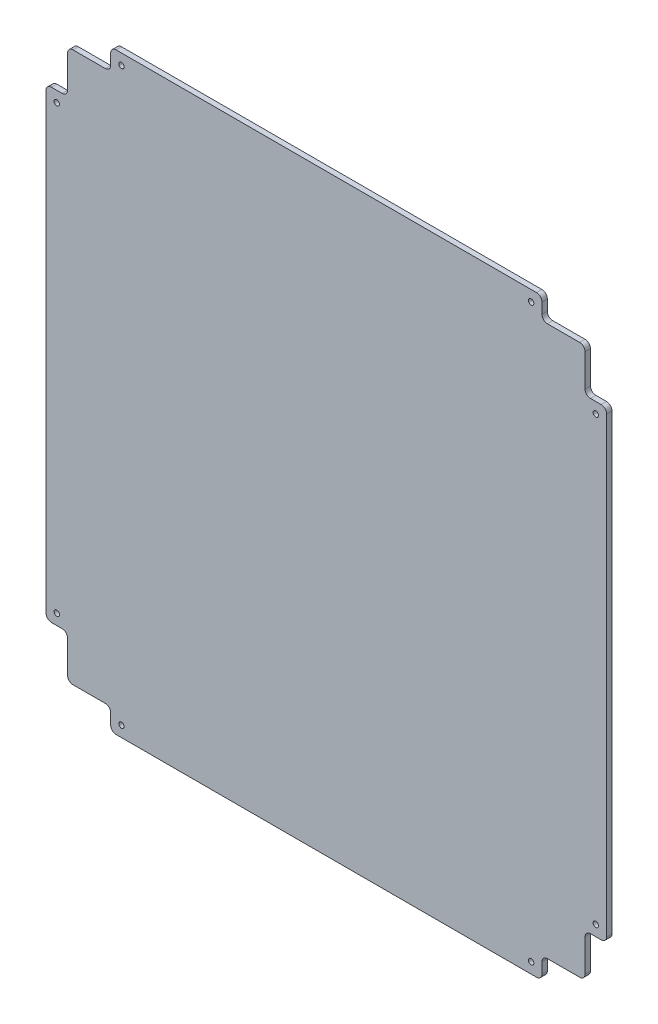
from build123d import *

# Parameters (mm, degrees)
SKETCH_1_W          = 520
SKETCH_1_H          = 550
EXTRUDE_1_DEPTH     = 5
SKETCH_2_R          = 2.5
CUT_EXTRUDE_2_DEPTH = 379.483817356
FILLET_2_R          = 5


with BuildPart() as part:
    # 草图1 → 凸台-拉伸1 (new body)
    with BuildSketch(Plane.XY):
        Rectangle(SKETCH_1_W, SKETCH_1_H)
    extrude(amount=EXTRUDE_1_DEPTH)

    # 草图2 → 切除-拉伸2 (cut, through all)
    with BuildSketch(Plane.XY.offset(5)):
        with Locations((-190, 265)):
            Circle(SKETCH_2_R)
        with Locations((190, 265)):
            Circle(SKETCH_2_R)
        with Locations((250, 205)):
            Circle(SKETCH_2_R)
        with Locations((-250, 205)):
            Circle(SKETCH_2_R)
        with Locations((-250, -205)):
            Circle(SKETCH_2_R)
        with Locations((-190, -265)):
            Circle(SKETCH_2_R)
        with Locations((190, -265)):
            Circle(SKETCH_2_R)
        with Locations((250, -205)):
            Circle(SKETCH_2_R)
        Polygon((240, 255), (200, 255), (200, 275), (260, 275), (260, 215), (240, 215), align=None)
        Polygon((-240, 255), (-240, 215), (-260, 215), (-260, 275), (-200, 275), (-200, 255), align=None)
        Polygon((-240, -255), (-200, -255), (-200, -275), (-260, -275), (-260, -215), (-240, -215), align=None)
        Polygon((240, -255), (240, -215), (260, -215), (260, -275), (200, -275), (200, -255), align=None)
    extrude(amount=-CUT_EXTRUDE_2_DEPTH, mode=Mode.SUBTRACT)

    # 圆角2
    fillet_2_edges = [part.edges().sort_by_distance(p)[0] for p in [
        (260, 215, 2.5),
        (240, 215, 2.5),
        (240, 255, 2.5),
        (200, 255, 2.5),
        (200, 275, 2.5),
        (-200, 275, 2.5),
        (-200, 255, 2.5),
        (-240, 255, 2.5),
        (-240, 215, 2.5),
        (-260, 215, 2.5),
        (-260, -215, 2.5),
        (-240, -215, 2.5),
        (-240, -255, 2.5),
        (-200, -255, 2.5),
        (-200, -275, 2.5),
        (200, -275, 2.5),
        (200, -255, 2.5),
        (240, -255, 2.5),
        (240, -215, 2.5),
        (260, -215, 2.5),
    ]]
    fillet(fillet_2_edges, radius=FILLET_2_R)


solid = part.part
